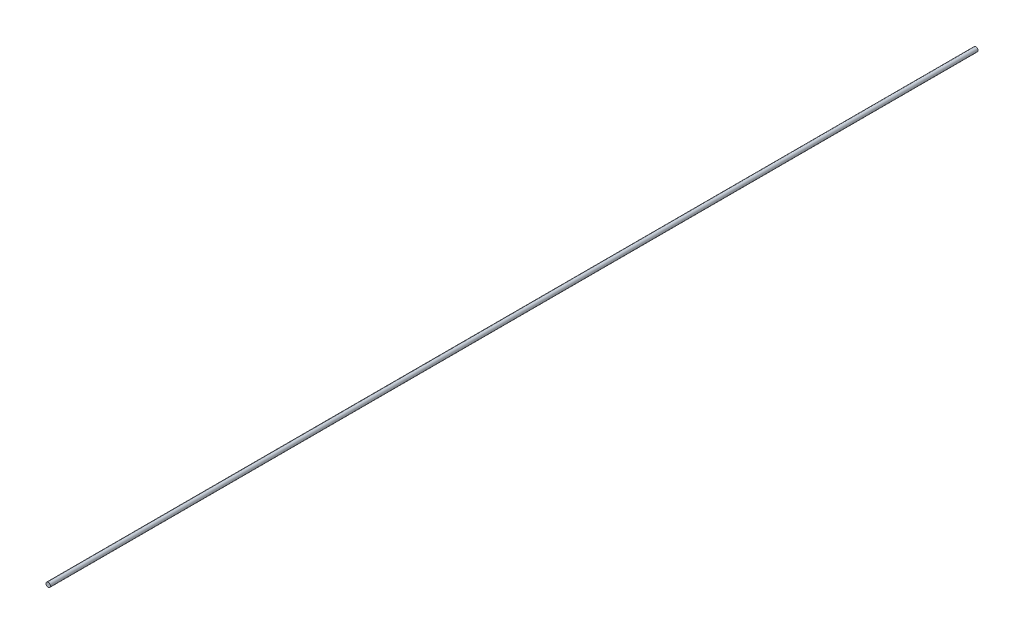
from build123d import *

# Parameters (mm, degrees)
SKETCH_1_R = 0.4
D0P8_DEPTH = 169.664140853


with BuildPart() as part:
    # 草图1 → D0p8钢索直线跨度 (new body)
    with BuildSketch(Plane.XY):
        Circle(SKETCH_1_R)
    extrude(amount=D0P8_DEPTH)


solid = part.part
